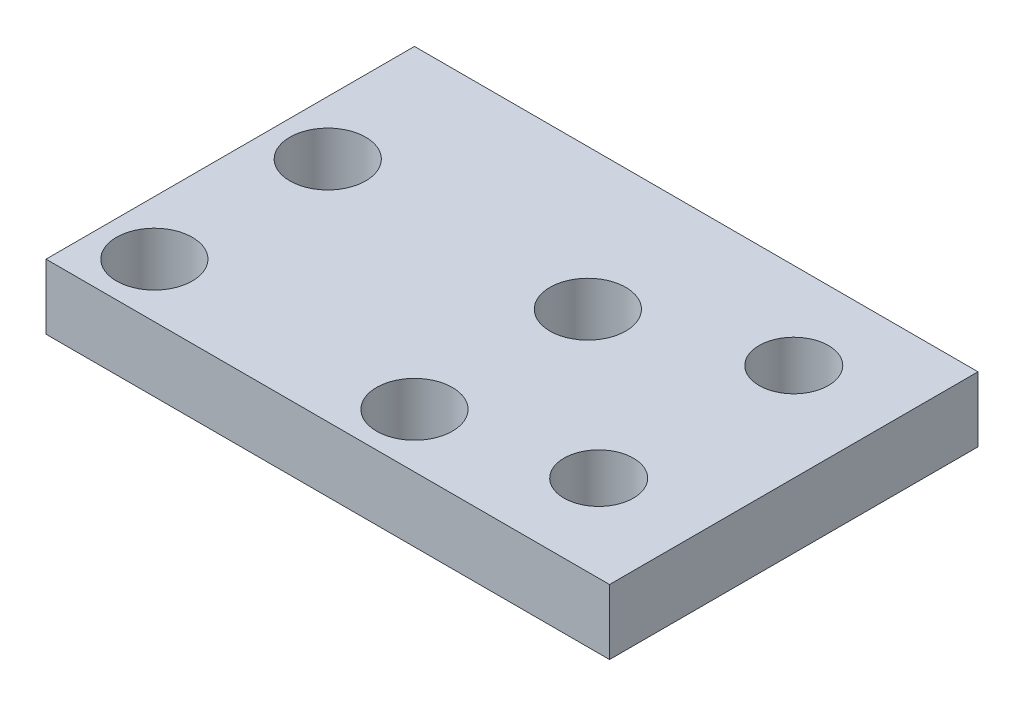
from build123d import *

# Parameters (mm, degrees)
SKETCH_1_W      = 26
SKETCH_1_H      = 17
SKETCH_1_R      = 1.75
SKETCH_1_R_2    = 1.6
EXTRUDE_1_DEPTH = 3


with BuildPart() as part:
    # 草图1 → 凸台-拉伸1 (new body)
    with BuildSketch(Plane(origin=(0, 0, 0), x_dir=(1, 0, 0), z_dir=(0, 1, 0))):
        with Locations((-13, 8.5)):
            Rectangle(SKETCH_1_W, SKETCH_1_H)
        with Locations(Location((-23.5, 10.5, 0), (0, 0, 270))):
            Circle(SKETCH_1_R, mode=Mode.SUBTRACT)
        with Locations(Location((-11.5, 10.5, 0), (0, 0, 270))):
            Circle(SKETCH_1_R, mode=Mode.SUBTRACT)
        with Locations(Location((-23.5, 2.5, 0), (0, 0, 270))):
            Circle(SKETCH_1_R, mode=Mode.SUBTRACT)
        with Locations(Location((-11.5, 2.5, 0), (0, 0, 270))):
            Circle(SKETCH_1_R, mode=Mode.SUBTRACT)
        with Locations(Location((-4.5, 13, 0), (0, 0, 270))):
            Circle(SKETCH_1_R_2, mode=Mode.SUBTRACT)
        with Locations(Location((-4.5, 4, 0), (0, 0, 270))):
            Circle(SKETCH_1_R_2, mode=Mode.SUBTRACT)
    extrude(amount=EXTRUDE_1_DEPTH)


solid = part.part
